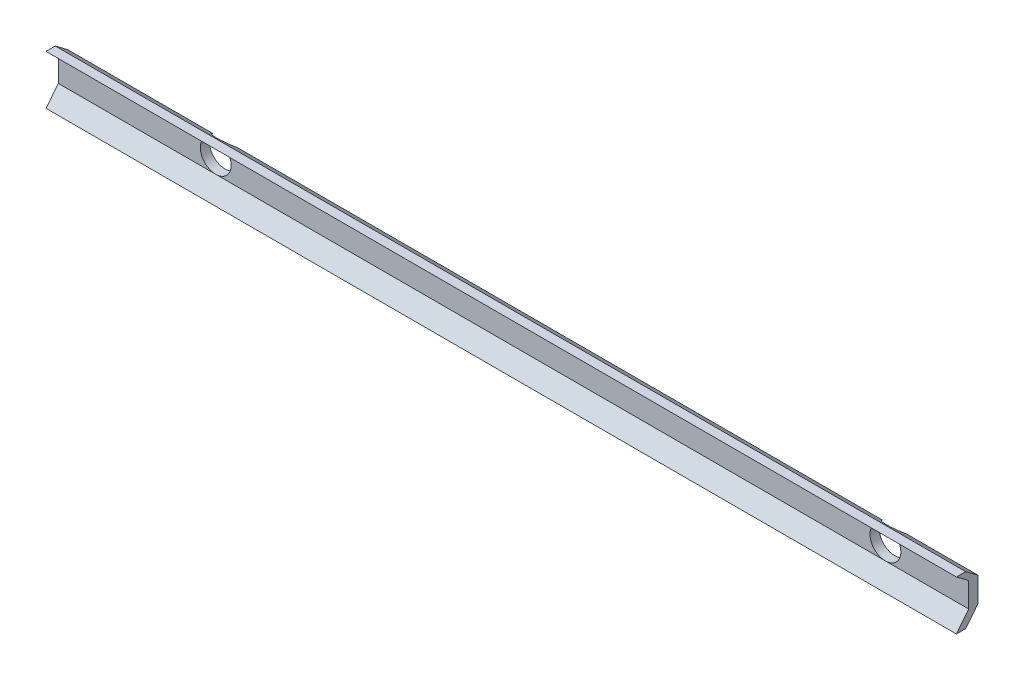
from build123d import *

# Parameters (mm, degrees)
MAIN_BODY_EXTRUDE_DEPTH       = 147.5
CROSS_BOLT_BORE_SKETCH_R      = 2.5
CROSS_BOLT_BORE_EXTRUDE_DEPTH = 148.758248501


with BuildPart() as part:
    # Main Body Sketch → Main Body Extrude (new body)
    with BuildSketch(Plane(origin=(0, 0, 0), x_dir=(0, 0, -1), z_dir=(1, 0, 0))):
        Polygon((0, 0), (2, -1.5), (2, -5.5), (0, -8), (1.5, -8), (3.5, -5.5), (3.5, -1.5), (1.5, 0), align=None)
    extrude(amount=-MAIN_BODY_EXTRUDE_DEPTH)

    # Cross Bolt Bore Sketch → Cross Bolt Bore Extrude (cut, through all)
    with BuildSketch(Plane(origin=(0, 0, -3.5), x_dir=(-1, 0, 0), z_dir=(0, 0, -1))):
        with Locations(Location((13.5, -3, 0), (0, 0, 143.130102354))):
            Circle(CROSS_BOLT_BORE_SKETCH_R)
        with Locations(Location((122, -3, 0), (0, 0, 36.869897646))):
            Circle(CROSS_BOLT_BORE_SKETCH_R)
    extrude(amount=-CROSS_BOLT_BORE_EXTRUDE_DEPTH, mode=Mode.SUBTRACT)


solid = part.part
